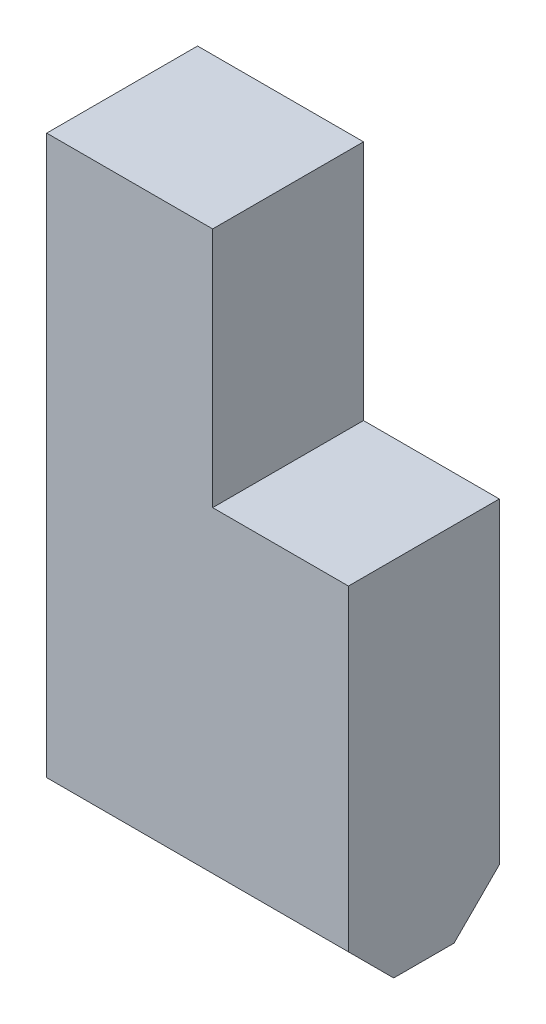
from build123d import *

# Parameters (mm, degrees)
BOSS_EXTRUDE1_DEPTH = 5
CHAMFER1_SIZE       = 3


with BuildPart() as part:
    # Sketch1 → Boss-Extrude1 (new, symmetric)
    with BuildSketch(Plane.XY):
        Polygon((20, 24), (11, 24), (11, 40), (0, 40), (0, 0), (20, 0), align=None)
    extrude(amount=BOSS_EXTRUDE1_DEPTH, both=True)

    # Chamfer1
    chamfer1_edges = [part.edges().sort_by_distance(p)[0] for p in [
        (10, 0, -5),
        (10, 0, 5),
    ]]
    chamfer(chamfer1_edges, length=CHAMFER1_SIZE)


solid = part.part
